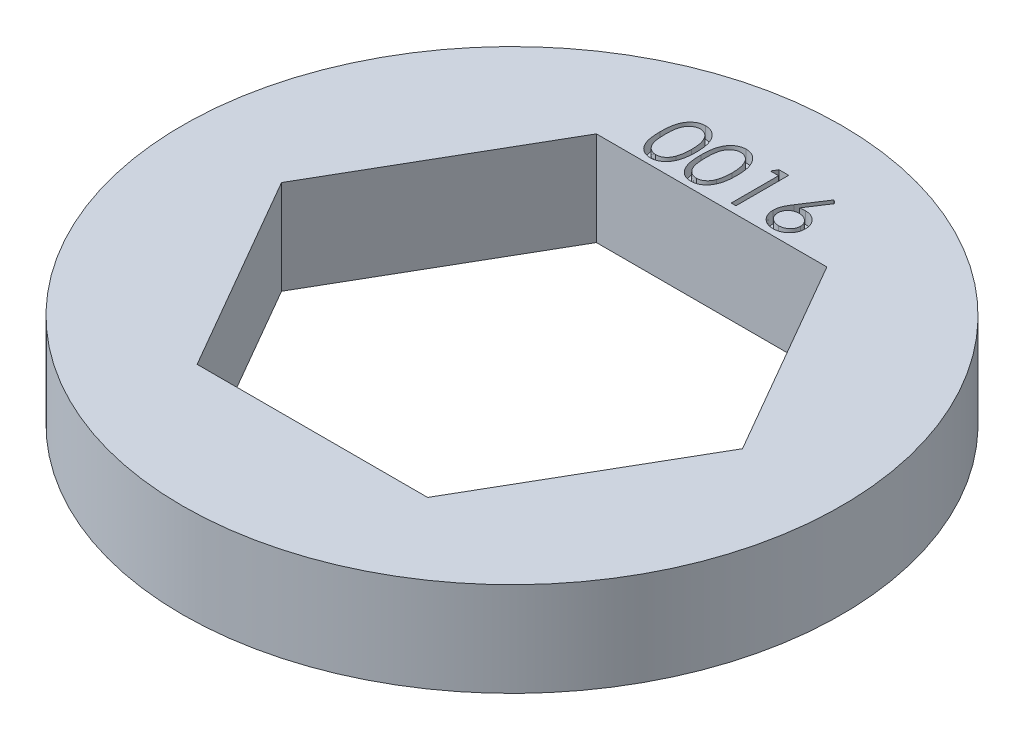
from build123d import *

# Parameters (mm, degrees)
SKETCH1_R           = 11.1125
BOSS_EXTRUDE1_DEPTH = 3.175
CUT_EXTRUDE1_DEPTH  = 0.4


with BuildPart() as part:
    # Sketch1 → Boss-Extrude1 (new body)
    with BuildSketch(Plane(origin=(0, 0, 0), x_dir=(1, 0, 0), z_dir=(0, 1, 0))):
        with Locations(Location((0, 0, 0), (0, 0, 270))):
            Circle(SKETCH1_R)
        Polygon((7.772289324, 0), (3.886144662, 6.731), (-3.886144662, 6.731), (-7.772289324, 0), (-3.886144662, -6.731), (3.886144662, -6.731), align=None, mode=Mode.SUBTRACT)
    extrude(amount=BOSS_EXTRUDE1_DEPTH)

    # Sketch2 → Cut-Extrude1 (cut)
    # profile 1 of 4: a face of its own
    with BuildSketch(Plane(origin=(0, 3.175, 0), x_dir=(1, 0, 0), z_dir=(0, 1, 0))):
        with BuildLine():
            add(Edge.make_bspline(
                [(-2.874712683, 7.87328766), (-2.87454605, 7.901785133), (-2.874222363, 7.957141885), (-2.870621445, 8.037804483), (-2.864639571, 8.11347631), (-2.856441785, 8.184160988), (-2.846465692, 8.249876764), (-2.833148224, 8.310448021), (-2.818003321, 8.366155101), (-2.800450678, 8.417179662), (-2.780644881, 8.464209135), (-2.759088277, 8.508113137), (-2.734925361, 8.548825239), (-2.70953709, 8.586995236), (-2.681895757, 8.621998313), (-2.652787972, 8.654328786), (-2.621077658, 8.683239447), (-2.58784277, 8.709577368), (-2.552782406, 8.7326657), (-2.516895932, 8.753002331), (-2.479936338, 8.770375864), (-2.441802717, 8.784036205), (-2.402837818, 8.795319315), (-2.362905428, 8.803035301), (-2.321939615, 8.80789021), (-2.294288446, 8.808354354), (-2.280265167, 8.808589744)],
                knots=[0, 0, 0, 0, 1.646270934, 3.197905019, 4.663502075, 6.030701355, 7.308322542, 8.50163776, 9.611534131, 10.641858119, 11.616356847, 12.558055219, 13.465016945, 14.349605745, 15.204443733, 16.039544428, 16.859896111, 17.680448484, 18.487036065, 19.28249412, 20.06191084, 20.843045899, 21.620316918, 22.403196591, 23.190181807, 24, 24, 24, 24], degree=3))
            add(Edge.make_bspline(
                [(-2.280265167, 8.808589744), (-2.266124744, 8.808341933), (-2.238003892, 8.807849117), (-2.196428981, 8.803112554), (-2.155814543, 8.795253224), (-2.116333728, 8.784117369), (-2.077662235, 8.770301965), (-2.04010254, 8.752985709), (-2.003421343, 8.732828845), (-1.968201557, 8.709143915), (-1.934056532, 8.682736919), (-1.901824967, 8.652885483), (-1.871503927, 8.619891026), (-1.842712872, 8.584106559), (-1.816268629, 8.544845736), (-1.791085325, 8.502791408), (-1.768544331, 8.457208129), (-1.746835116, 8.408856451), (-1.728096527, 8.356398512), (-1.711197274, 8.300130014), (-1.697542758, 8.239386327), (-1.686169008, 8.174486154), (-1.6773578, 8.105191153), (-1.670940418, 8.031649865), (-1.667550491, 7.953813906), (-1.666912087, 7.900596919), (-1.666584478, 7.87328766)],
                knots=[0, 0, 0, 0, 0.810914788, 1.612654377, 2.396697861, 3.181598691, 3.963628158, 4.749916497, 5.551656086, 6.361998678, 7.18212741, 8.025565596, 8.878627764, 9.750805457, 10.657531673, 11.591944965, 12.560506719, 13.57287815, 14.630710178, 15.753379473, 16.941251878, 18.199788006, 19.531962791, 20.947069417, 22.433333509, 24, 24, 24, 24], degree=3))
            add(Edge.make_bspline(
                [(-1.666584478, 7.87328766), (-1.666915483, 7.846097515), (-1.667560433, 7.793118626), (-1.670902416, 7.71563289), (-1.6774854, 7.642481884), (-1.685720074, 7.573490169), (-1.697125164, 7.508944899), (-1.711148588, 7.448622719), (-1.726718952, 7.392263131), (-1.745939028, 7.340327847), (-1.766975668, 7.292092371), (-1.789863708, 7.24704946), (-1.81438478, 7.204800983), (-1.841099862, 7.165685112), (-1.869574996, 7.129424754), (-1.900419633, 7.096659962), (-1.93276429, 7.06660126), (-1.967009797, 7.039854234), (-2.002778865, 7.016443153), (-2.039334076, 6.995506517), (-2.077324035, 6.978624308), (-2.115887815, 6.964128507), (-2.155577025, 6.953053877), (-2.196342192, 6.945396359), (-2.237975959, 6.94002586), (-2.266119954, 6.939616168), (-2.280265167, 6.939410256)],
                knots=[0, 0, 0, 0, 1.561518951, 3.042555995, 4.452378317, 5.7783523, 7.031515105, 8.214008947, 9.334062868, 10.386615937, 11.391082383, 12.354592575, 13.286541444, 14.194233754, 15.072674879, 15.931287219, 16.775624067, 17.606195743, 18.42308326, 19.229000347, 20.022332153, 20.807536673, 21.593273796, 22.3848459, 23.188221202, 24, 24, 24, 24], degree=3))
            add(Edge.make_bspline(
                [(-2.280265167, 6.939410256), (-2.294288057, 6.939647165), (-2.321938459, 6.940114302), (-2.362909891, 6.944947278), (-2.402677372, 6.952717394), (-2.441437139, 6.963597029), (-2.479388049, 6.976914165), (-2.516012963, 6.994264237), (-2.551719106, 7.014245944), (-2.586411216, 7.037002018), (-2.619437394, 7.063073433), (-2.650983486, 7.091909691), (-2.680256995, 7.124230384), (-2.707503116, 7.159525169), (-2.733397953, 7.197469336), (-2.757217754, 7.23858095), (-2.779250148, 7.282696996), (-2.799389042, 7.330102495), (-2.817244563, 7.381489198), (-2.833016798, 7.437444981), (-2.84546999, 7.498463724), (-2.856129332, 7.564055346), (-2.864726918, 7.634501703), (-2.870596516, 7.709841038), (-2.874224304, 7.790026404), (-2.874546919, 7.84502745), (-2.874712683, 7.87328766)],
                knots=[0, 0, 0, 0, 0.810891512, 1.598919785, 2.382837074, 3.152667961, 3.926044502, 4.706494248, 5.493654104, 6.291793342, 7.103789334, 7.925228297, 8.761435821, 9.622817696, 10.50288917, 11.416980706, 12.369136599, 13.353924996, 14.394355917, 15.514179734, 16.714354668, 17.994756427, 19.357759367, 20.818452758, 22.365282078, 24, 24, 24, 24], degree=3))
        make_face()
        with BuildLine():
            add(Edge.make_bspline(
                [(-2.715148581, 7.874), (-2.715087902, 7.850251661), (-2.714970135, 7.804160798), (-2.711893585, 7.737184422), (-2.707702468, 7.674715495), (-2.702296689, 7.616674698), (-2.694268791, 7.563258492), (-2.685273743, 7.514099493), (-2.674327313, 7.469457856), (-2.661375844, 7.429027248), (-2.646623983, 7.392121522), (-2.630517404, 7.357780104), (-2.613214557, 7.325597321), (-2.593850028, 7.295862248), (-2.572760376, 7.268477916), (-2.550421961, 7.242959637), (-2.526001088, 7.220202771), (-2.492217187, 7.192909529), (-2.447616578, 7.164705809), (-2.391421386, 7.140145995), (-2.333677813, 7.124711707), (-2.294484978, 7.122748919), (-2.274922619, 7.121769231)],
                knots=[0, 0, 0, 0, 1.459021318, 2.831673884, 4.118529203, 5.306027144, 6.411944654, 7.436330062, 8.375795394, 9.233974572, 10.042671642, 10.816086306, 11.563610507, 12.285937304, 12.993564865, 13.685989202, 14.367179055, 15.041617293, 16.353048772, 17.594441528, 18.799311195, 20, 20, 20, 20], degree=3))
            add(Edge.make_bspline(
                [(-2.274922619, 7.121769231), (-2.255233722, 7.122580903), (-2.215896578, 7.124202573), (-2.15842461, 7.139848332), (-2.102630833, 7.163454858), (-2.058906287, 7.19136819), (-2.025641155, 7.217950982), (-2.001807324, 7.240615223), (-1.979931803, 7.265992804), (-1.959184029, 7.293373646), (-1.940154819, 7.323280868), (-1.922850745, 7.355570656), (-1.907060404, 7.390332679), (-1.898064209, 7.414599706), (-1.893464686, 7.427006811)],
                knots=[0, 0, 0, 0, 1.353760809, 2.704726607, 4.075137775, 5.516104923, 6.260822281, 7.007110065, 7.778089737, 8.566572457, 9.372053459, 10.217411131, 11.088608312, 12, 12, 12, 12], degree=3))
            add(Edge.make_bspline(
                [(-1.893464686, 7.427006811), (-1.888104388, 7.442871519), (-1.877220685, 7.475083679), (-1.863193903, 7.525052414), (-1.852147241, 7.577479418), (-1.842209051, 7.632051377), (-1.835425698, 7.689170746), (-1.829965809, 7.748660789), (-1.82674982, 7.810566361), (-1.826351167, 7.852626216), (-1.826148581, 7.874)],
                knots=[0, 0, 0, 0, 0.884706709, 1.796334032, 2.740027952, 3.714592787, 4.726048262, 5.777819803, 6.87074269, 8, 8, 8, 8], degree=3))
            add(Edge.make_bspline(
                [(-1.826148581, 7.874), (-1.826428077, 7.895370327), (-1.826974831, 7.937175255), (-1.829064737, 7.99839849), (-1.834461513, 8.056548113), (-1.840455465, 8.111874633), (-1.849293253, 8.164071787), (-1.858822219, 8.213576542), (-1.871624435, 8.259775598), (-1.885299681, 8.303392266), (-1.900951362, 8.343930998), (-1.918180555, 8.381580802), (-1.936581208, 8.416523442), (-1.956567066, 8.448663048), (-1.977900873, 8.47814358), (-2.001145708, 8.504373954), (-2.02537953, 8.528167134), (-2.05932266, 8.555326119), (-2.103759599, 8.58301806), (-2.159053188, 8.608502266), (-2.216594675, 8.623136879), (-2.25549399, 8.625200216), (-2.274922619, 8.626230769)],
                knots=[0, 0, 0, 0, 1.31362396, 2.569729283, 3.763502607, 4.902122613, 5.988968491, 7.01645872, 7.998833611, 8.933434873, 9.825090667, 10.667526885, 11.477055099, 12.250526234, 12.991942729, 13.710640831, 14.402115721, 15.076753259, 16.378508321, 17.609869233, 18.806226677, 20, 20, 20, 20], degree=3))
            add(Edge.make_bspline(
                [(-2.274922619, 8.626230769), (-2.2945876, 8.625198794), (-2.333953386, 8.623132965), (-2.392092947, 8.608556792), (-2.447822758, 8.583150205), (-2.492142189, 8.5552344), (-2.526108993, 8.528646538), (-2.550027001, 8.505590219), (-2.572453256, 8.480369922), (-2.593112448, 8.452733749), (-2.612461804, 8.423033342), (-2.630232158, 8.39103505), (-2.646242962, 8.356576717), (-2.661017906, 8.319687568), (-2.674008883, 8.279260448), (-2.684724616, 8.234673799), (-2.694624039, 8.185671158), (-2.701632035, 8.131965648), (-2.707862023, 8.073910314), (-2.711865748, 8.011285437), (-2.714980427, 7.944196731), (-2.715091407, 7.897867559), (-2.715148581, 7.874)],
                knots=[0, 0, 0, 0, 1.207732386, 2.417664972, 3.655092373, 4.956220595, 5.625982001, 6.301752483, 6.994047911, 7.697131622, 8.419323945, 9.170223765, 9.943494443, 10.752040957, 11.610060368, 12.549350801, 13.567764191, 14.679664412, 15.874934091, 17.154273443, 18.533957287, 20, 20, 20, 20], degree=3))
        make_face(mode=Mode.SUBTRACT)
    # profile 2 of 4: a face of its own
    with BuildSketch(Plane(origin=(0, 3.175, 0), x_dir=(1, 0, 0), z_dir=(0, 1, 0))):
        with BuildLine():
            add(Edge.make_bspline(
                [(-1.507020376, 7.87328766), (-1.506853742, 7.901785133), (-1.506530055, 7.957141885), (-1.502929137, 8.037804483), (-1.496947263, 8.11347631), (-1.488749478, 8.184160988), (-1.478773384, 8.249876764), (-1.465455917, 8.310448021), (-1.450311013, 8.366155101), (-1.43275837, 8.417179662), (-1.412952574, 8.464209135), (-1.391395969, 8.508113137), (-1.367233054, 8.548825239), (-1.341844782, 8.586995236), (-1.314203449, 8.621998313), (-1.285095664, 8.654328786), (-1.253385351, 8.683239447), (-1.220150463, 8.709577368), (-1.185090099, 8.7326657), (-1.149203624, 8.753002331), (-1.11224403, 8.770375864), (-1.07411041, 8.784036205), (-1.03514551, 8.795319315), (-0.99521312, 8.803035301), (-0.954247307, 8.80789021), (-0.926596139, 8.808354354), (-0.91257286, 8.808589744)],
                knots=[0, 0, 0, 0, 1.646270934, 3.197905019, 4.663502075, 6.030701355, 7.308322542, 8.50163776, 9.611534131, 10.641858119, 11.616356847, 12.558055219, 13.465016945, 14.349605745, 15.204443733, 16.039544428, 16.859896111, 17.680448484, 18.487036065, 19.28249412, 20.06191084, 20.843045899, 21.620316918, 22.403196591, 23.190181807, 24, 24, 24, 24], degree=3))
            add(Edge.make_bspline(
                [(-0.91257286, 8.808589744), (-0.898432437, 8.808341933), (-0.870311584, 8.807849117), (-0.828736673, 8.803112554), (-0.788122235, 8.795253224), (-0.748641421, 8.784117369), (-0.709969927, 8.770301965), (-0.672410232, 8.752985709), (-0.635729035, 8.732828845), (-0.600509249, 8.709143915), (-0.566364224, 8.682736919), (-0.534132659, 8.652885483), (-0.503811619, 8.619891026), (-0.475020564, 8.584106559), (-0.448576321, 8.544845736), (-0.423393017, 8.502791408), (-0.400852023, 8.457208129), (-0.379142808, 8.408856451), (-0.360404219, 8.356398512), (-0.343504966, 8.300130014), (-0.32985045, 8.239386327), (-0.3184767, 8.174486154), (-0.309665493, 8.105191153), (-0.303248111, 8.031649865), (-0.299858183, 7.953813906), (-0.299219779, 7.900596919), (-0.29889217, 7.87328766)],
                knots=[0, 0, 0, 0, 0.810914788, 1.612654377, 2.396697861, 3.181598691, 3.963628158, 4.749916497, 5.551656086, 6.361998678, 7.18212741, 8.025565596, 8.878627764, 9.750805457, 10.657531673, 11.591944965, 12.560506719, 13.57287815, 14.630710178, 15.753379473, 16.941251878, 18.199788006, 19.531962791, 20.947069417, 22.433333509, 24, 24, 24, 24], degree=3))
            add(Edge.make_bspline(
                [(-0.29889217, 7.87328766), (-0.299223175, 7.846097515), (-0.299868125, 7.793118626), (-0.303210108, 7.71563289), (-0.309793093, 7.642481884), (-0.318027767, 7.573490169), (-0.329432856, 7.508944899), (-0.34345628, 7.448622719), (-0.359026644, 7.392263131), (-0.37824672, 7.340327847), (-0.399283361, 7.292092371), (-0.4221714, 7.24704946), (-0.446692472, 7.204800983), (-0.473407554, 7.165685112), (-0.501882688, 7.129424754), (-0.532727325, 7.096659962), (-0.565071982, 7.06660126), (-0.59931749, 7.039854234), (-0.635086558, 7.016443153), (-0.671641769, 6.995506517), (-0.709631727, 6.978624308), (-0.748195507, 6.964128507), (-0.787884717, 6.953053877), (-0.828649884, 6.945396359), (-0.870283652, 6.94002586), (-0.898427647, 6.939616168), (-0.91257286, 6.939410256)],
                knots=[0, 0, 0, 0, 1.561518951, 3.042555995, 4.452378317, 5.7783523, 7.031515105, 8.214008947, 9.334062868, 10.386615937, 11.391082383, 12.354592575, 13.286541444, 14.194233754, 15.072674879, 15.931287219, 16.775624067, 17.606195743, 18.42308326, 19.229000347, 20.022332153, 20.807536673, 21.593273796, 22.3848459, 23.188221202, 24, 24, 24, 24], degree=3))
            add(Edge.make_bspline(
                [(-0.91257286, 6.939410256), (-0.926595749, 6.939647165), (-0.954246151, 6.940114302), (-0.995217583, 6.944947278), (-1.034985065, 6.952717394), (-1.073744832, 6.963597029), (-1.111695741, 6.976914165), (-1.148320655, 6.994264237), (-1.184026798, 7.014245944), (-1.218718909, 7.037002018), (-1.251745087, 7.063073433), (-1.283291178, 7.091909691), (-1.312564688, 7.124230384), (-1.339810808, 7.159525169), (-1.365705645, 7.197469336), (-1.389525447, 7.23858095), (-1.411557841, 7.282696996), (-1.431696734, 7.330102495), (-1.449552255, 7.381489198), (-1.465324491, 7.437444981), (-1.477777683, 7.498463724), (-1.488437024, 7.564055346), (-1.497034611, 7.634501703), (-1.502904208, 7.709841038), (-1.506531996, 7.790026404), (-1.506854612, 7.84502745), (-1.507020376, 7.87328766)],
                knots=[0, 0, 0, 0, 0.810891512, 1.598919785, 2.382837074, 3.152667961, 3.926044502, 4.706494248, 5.493654104, 6.291793342, 7.103789334, 7.925228297, 8.761435821, 9.622817696, 10.50288917, 11.416980706, 12.369136599, 13.353924996, 14.394355917, 15.514179734, 16.714354668, 17.994756427, 19.357759367, 20.818452758, 22.365282078, 24, 24, 24, 24], degree=3))
        make_face()
        with BuildLine():
            add(Edge.make_bspline(
                [(-1.347456273, 7.874), (-1.347395594, 7.850251661), (-1.347277828, 7.804160798), (-1.344201278, 7.737184422), (-1.34001016, 7.674715495), (-1.334604381, 7.616674698), (-1.326576483, 7.563258492), (-1.317581435, 7.514099493), (-1.306635005, 7.469457856), (-1.293683536, 7.429027248), (-1.278931675, 7.392121522), (-1.262825096, 7.357780104), (-1.245522249, 7.325597321), (-1.226157721, 7.295862248), (-1.205068069, 7.268477916), (-1.182729653, 7.242959637), (-1.15830878, 7.220202771), (-1.124524879, 7.192909529), (-1.07992427, 7.164705809), (-1.023729079, 7.140145995), (-0.965985505, 7.124711707), (-0.92679267, 7.122748919), (-0.907230311, 7.121769231)],
                knots=[0, 0, 0, 0, 1.459021318, 2.831673884, 4.118529203, 5.306027144, 6.411944654, 7.436330062, 8.375795394, 9.233974572, 10.042671642, 10.816086306, 11.563610507, 12.285937304, 12.993564865, 13.685989202, 14.367179055, 15.041617293, 16.353048772, 17.594441528, 18.799311195, 20, 20, 20, 20], degree=3))
            add(Edge.make_bspline(
                [(-0.907230311, 7.121769231), (-0.887541414, 7.122580903), (-0.84820427, 7.124202573), (-0.790732302, 7.139848332), (-0.734938525, 7.163454858), (-0.691213979, 7.19136819), (-0.657948847, 7.217950982), (-0.634115016, 7.240615223), (-0.612239496, 7.265992804), (-0.591491722, 7.293373646), (-0.572462511, 7.323280868), (-0.555158437, 7.355570656), (-0.539368097, 7.390332679), (-0.530371901, 7.414599706), (-0.525772379, 7.427006811)],
                knots=[0, 0, 0, 0, 1.353760809, 2.704726607, 4.075137775, 5.516104923, 6.260822281, 7.007110065, 7.778089737, 8.566572457, 9.372053459, 10.217411131, 11.088608312, 12, 12, 12, 12], degree=3))
            add(Edge.make_bspline(
                [(-0.525772379, 7.427006811), (-0.520412081, 7.442871519), (-0.509528377, 7.475083679), (-0.495501596, 7.525052414), (-0.484454933, 7.577479418), (-0.474516743, 7.632051377), (-0.467733391, 7.689170746), (-0.462273501, 7.748660789), (-0.459057513, 7.810566361), (-0.458658859, 7.852626216), (-0.458456273, 7.874)],
                knots=[0, 0, 0, 0, 0.884706709, 1.796334032, 2.740027952, 3.714592787, 4.726048262, 5.777819803, 6.87074269, 8, 8, 8, 8], degree=3))
            add(Edge.make_bspline(
                [(-0.458456273, 7.874), (-0.458735769, 7.895370327), (-0.459282523, 7.937175255), (-0.461372429, 7.99839849), (-0.466769205, 8.056548113), (-0.472763157, 8.111874633), (-0.481600946, 8.164071787), (-0.491129912, 8.213576542), (-0.503932127, 8.259775598), (-0.517607373, 8.303392266), (-0.533259054, 8.343930998), (-0.550488247, 8.381580802), (-0.5688889, 8.416523442), (-0.588874759, 8.448663048), (-0.610208566, 8.47814358), (-0.633453401, 8.504373954), (-0.657687222, 8.528167134), (-0.691630352, 8.555326119), (-0.736067292, 8.58301806), (-0.79136088, 8.608502266), (-0.848902368, 8.623136879), (-0.887801682, 8.625200216), (-0.907230311, 8.626230769)],
                knots=[0, 0, 0, 0, 1.31362396, 2.569729283, 3.763502607, 4.902122613, 5.988968491, 7.01645872, 7.998833611, 8.933434873, 9.825090667, 10.667526885, 11.477055099, 12.250526234, 12.991942729, 13.710640831, 14.402115721, 15.076753259, 16.378508321, 17.609869233, 18.806226677, 20, 20, 20, 20], degree=3))
            add(Edge.make_bspline(
                [(-0.907230311, 8.626230769), (-0.926895292, 8.625198794), (-0.966261079, 8.623132965), (-1.02440064, 8.608556792), (-1.08013045, 8.583150205), (-1.124449881, 8.5552344), (-1.158416685, 8.528646538), (-1.182334693, 8.505590219), (-1.204760949, 8.480369922), (-1.22542014, 8.452733749), (-1.244769496, 8.423033342), (-1.262539851, 8.39103505), (-1.278550654, 8.356576717), (-1.293325599, 8.319687568), (-1.306316575, 8.279260448), (-1.317032308, 8.234673799), (-1.326931731, 8.185671158), (-1.333939728, 8.131965648), (-1.340169716, 8.073910314), (-1.34417344, 8.011285437), (-1.347288119, 7.944196731), (-1.347399099, 7.897867559), (-1.347456273, 7.874)],
                knots=[0, 0, 0, 0, 1.207732386, 2.417664972, 3.655092373, 4.956220595, 5.625982001, 6.301752483, 6.994047911, 7.697131622, 8.419323945, 9.170223765, 9.943494443, 10.752040957, 11.610060368, 12.549350801, 13.567764191, 14.679664412, 15.874934091, 17.154273443, 18.533957287, 20, 20, 20, 20], degree=3))
        make_face(mode=Mode.SUBTRACT)
    # profile 3 of 4: a face of its own
    with BuildSketch(Plane(origin=(0, 3.175, 0), x_dir=(1, 0, 0), z_dir=(0, 1, 0))):
        Polygon((0.238568166, 8.763), (0.567312958, 8.763), (0.567312958, 6.985), (0.407748855, 6.985), (0.407748855, 8.580641026), (0.134210394, 8.580641026), align=None)
    # profile 4 of 4: a face of its own
    with BuildSketch(Plane(origin=(0, 3.175, 0), x_dir=(1, 0, 0), z_dir=(0, 1, 0))):
        with BuildLine():
            Line((2.048979624, 8.808589744), (2.17185823, 8.712067708))
            Line((2.17185823, 8.712067708), (1.702070169, 7.993673077))
            add(Edge.make_bspline(
                [(1.702070169, 7.993673077), (1.73334787, 7.998658518), (1.794358562, 8.008383185), (1.856114038, 8.009987421), (1.886209993, 8.010769231)],
                knots=[0, 0, 0, 0, 1.025318673, 2, 2, 2, 2], degree=3))
            add(Edge.make_bspline(
                [(1.886209993, 8.010769231), (1.904280821, 8.010283526), (1.939852709, 8.009327431), (1.992078564, 8.001969635), (2.042263344, 7.990374478), (2.090199043, 7.973472172), (2.136057717, 7.951880976), (2.180102535, 7.92600403), (2.221505556, 7.894505144), (2.260799955, 7.859318546), (2.29647532, 7.820346318), (2.328060756, 7.778994439), (2.354591967, 7.735305992), (2.376117919, 7.689303104), (2.392833597, 7.641056688), (2.405019321, 7.590628473), (2.412222554, 7.537983686), (2.413200703, 7.502180773), (2.413697573, 7.48399399)],
                knots=[0, 0, 0, 0, 1.04369286, 2.054478336, 3.041073146, 4.015093852, 4.984733326, 5.965804835, 6.960378782, 7.985147595, 9.009457201, 10.008161701, 10.986880575, 11.956520048, 12.937015923, 13.931873656, 14.949455224, 16, 16, 16, 16], degree=3))
            add(Edge.make_bspline(
                [(2.413697573, 7.48399399), (2.412974636, 7.459112301), (2.411552066, 7.410151024), (2.397376938, 7.338839657), (2.375350238, 7.270903539), (2.343865654, 7.207427328), (2.304758603, 7.148498023), (2.257068786, 7.096283006), (2.202487494, 7.049714628), (2.140772201, 7.010773065), (2.074354775, 6.978970715), (2.00457996, 6.956128372), (1.93212537, 6.94206517), (1.882948629, 6.940302103), (1.858072573, 6.939410256)],
                knots=[0, 0, 0, 0, 1.031375318, 2.029502543, 3.004789286, 3.987476834, 4.960371455, 5.9300674, 6.912260825, 7.929083631, 8.949397511, 9.960523116, 10.96833055, 12, 12, 12, 12], degree=3))
            add(Edge.make_bspline(
                [(1.858072573, 6.939410256), (1.834147449, 6.940186585), (1.786755968, 6.941724356), (1.717041708, 6.955423052), (1.650055295, 6.97762626), (1.58626605, 7.008215114), (1.527175178, 7.046852518), (1.474309835, 7.093366156), (1.427933614, 7.146761765), (1.389338506, 7.207031061), (1.35872707, 7.271795959), (1.335770588, 7.339328035), (1.322361297, 7.409381226), (1.32048751, 7.456869644), (1.319543727, 7.480788462)],
                knots=[0, 0, 0, 0, 1.012016664, 2.004627821, 2.994792927, 3.992885782, 4.990978636, 5.973936114, 6.964471063, 7.975201453, 8.993600317, 9.990122807, 10.98767138, 12, 12, 12, 12], degree=3))
            add(Edge.make_bspline(
                [(1.319543727, 7.480788462), (1.320143901, 7.49909911), (1.321369342, 7.536485955), (1.329925784, 7.593109681), (1.3436747, 7.651047631), (1.359072305, 7.700198761), (1.375341315, 7.740463614), (1.388880805, 7.772926587), (1.405733195, 7.806333213), (1.423702873, 7.84182902), (1.444407362, 7.87849922), (1.466919712, 7.916956684), (1.491862335, 7.956589791), (1.509347777, 7.983485442), (1.518286515, 7.997234776)],
                knots=[0, 0, 0, 0, 1.173818275, 2.396712641, 3.66331629, 4.989737886, 5.693666774, 6.447286557, 7.243889047, 8.091586357, 8.998013824, 9.943181721, 10.948533338, 12, 12, 12, 12], degree=3))
            Line((1.518286515, 7.997234776), (2.048979624, 8.808589744))
        make_face()
        with BuildLine():
            add(Edge.make_bspline(
                [(1.852730025, 7.828410256), (1.839185605, 7.82801501), (1.812729417, 7.82724298), (1.77391445, 7.822759752), (1.737179319, 7.814317266), (1.702037335, 7.80356477), (1.669145502, 7.788780415), (1.638264771, 7.770821701), (1.609275725, 7.749678143), (1.582482, 7.72564928), (1.558189611, 7.699340959), (1.537269597, 7.671162442), (1.519224218, 7.641792827), (1.504552254, 7.61098672), (1.493127295, 7.578755898), (1.484863024, 7.5452486), (1.480263718, 7.510240132), (1.479498553, 7.486500021), (1.47910783, 7.474377404)],
                knots=[0, 0, 0, 0, 1.129588631, 2.206414736, 3.251139165, 4.268635594, 5.265702196, 6.250456724, 7.242448911, 8.251968645, 9.246821453, 10.222880186, 11.173611482, 12.116736599, 13.062300278, 14.020270554, 14.989073742, 16, 16, 16, 16], degree=3))
            add(Edge.make_bspline(
                [(1.47910783, 7.474377404), (1.479426021, 7.462363214), (1.480049948, 7.438805176), (1.485715326, 7.404088873), (1.494369148, 7.3706803), (1.507242069, 7.338751688), (1.522597328, 7.307816358), (1.542869233, 7.278994833), (1.56533136, 7.250536637), (1.592181158, 7.22462789), (1.620996627, 7.200519925), (1.651782038, 7.179447956), (1.683867297, 7.16142098), (1.71768558, 7.147292942), (1.752757079, 7.135698205), (1.789374, 7.127538973), (1.827561811, 7.122926066), (1.853430155, 7.122159904), (1.86662065, 7.121769231)],
                knots=[0, 0, 0, 0, 0.989467248, 1.94019797, 2.891935182, 3.827694429, 4.772920941, 5.730924762, 6.725747692, 7.756678648, 8.79901574, 9.819492441, 10.826891316, 11.826466727, 12.835195252, 13.867842842, 14.912794438, 16, 16, 16, 16], degree=3))
            add(Edge.make_bspline(
                [(1.86662065, 7.121769231), (1.879811123, 7.122159934), (1.905679425, 7.122926157), (1.943867543, 7.127538628), (1.980483329, 7.13569947), (2.015558955, 7.147288357), (2.049362002, 7.161437991), (2.081419201, 7.179335806), (2.111913472, 7.200649514), (2.140747857, 7.224586691), (2.167485898, 7.2506841), (2.190486755, 7.278740799), (2.210137838, 7.308049298), (2.226106405, 7.338629826), (2.238837541, 7.370699606), (2.247535246, 7.404083701), (2.253188925, 7.438806531), (2.253814459, 7.462363671), (2.254133471, 7.474377404)],
                knots=[0, 0, 0, 0, 1.087397944, 2.132534446, 3.165364764, 4.174271784, 5.174024072, 6.181601208, 7.194203697, 8.236725232, 9.267838612, 10.269026844, 11.221737037, 12.171628256, 13.107553087, 14.05945871, 15.010357665, 16, 16, 16, 16], degree=3))
            add(Edge.make_bspline(
                [(2.254133471, 7.474377404), (2.253853922, 7.486515836), (2.253305258, 7.51033963), (2.247099556, 7.54523294), (2.23849283, 7.578926145), (2.225496651, 7.611207487), (2.208612486, 7.641949578), (2.188046915, 7.671307711), (2.16425597, 7.699506968), (2.13677442, 7.725700874), (2.106858181, 7.74965159), (2.075049463, 7.770794324), (2.041771413, 7.788637813), (2.00705777, 7.80352582), (1.970510786, 7.814269753), (1.932720493, 7.822729601), (1.893203558, 7.827231506), (1.866393041, 7.828012335), (1.852730025, 7.828410256)],
                knots=[0, 0, 0, 0, 0.978206639, 1.919901502, 2.851605144, 3.780102724, 4.718870031, 5.675451981, 6.667674623, 7.690630536, 8.733308323, 9.756129687, 10.767539656, 11.776269907, 12.797430371, 13.836405707, 14.897401972, 16, 16, 16, 16], degree=3))
        make_face(mode=Mode.SUBTRACT)
    extrude(amount=-CUT_EXTRUDE1_DEPTH, mode=Mode.SUBTRACT)


solid = part.part
